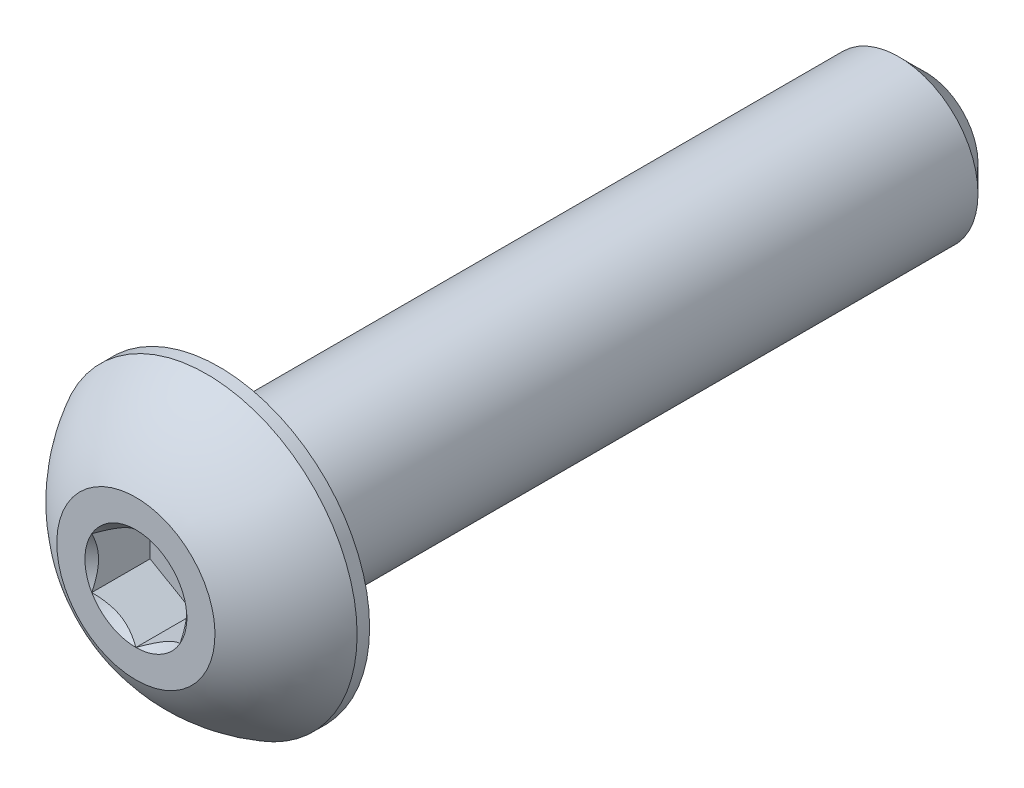
from build123d import *

# Parameters (mm, degrees)
SKETCH1_W          = 12.7
SKETCH1_H          = 1.4224
CHAMFER1_SIZE      = 0.47625
CUT_EXTRUDE2_DEPTH = 1.04902


with BuildPart() as part:
    # Sketch1 → Revolve1 (revolve)
    with BuildSketch(Plane(origin=(0, 0, 0), x_dir=(0, 0, -1), z_dir=(1, 0, 0))):
        with Locations((7.8486, 0.7112)):
            Rectangle(SKETCH1_W, SKETCH1_H)
    revolve(axis=Axis((0, 0, -14.1986), (0, 0, 1)))

    # Chamfer1
    chamfer1_edges = [part.edges().sort_by_distance(p)[0] for p in [
        (0, -1.4224, -14.1986),
    ]]
    chamfer(chamfer1_edges, length=CHAMFER1_SIZE)

    # Sketch7 → Revolve2 (revolve)
    with BuildSketch(Plane(origin=(0, 0, 0), x_dir=(0, 0, -1), z_dir=(1, 0, 0))):
        with BuildLine():
            Line((1.27381, 2.7051), (1.4986, 2.7051))
            Line((1.4986, 2.7051), (1.4986, 0))
            Line((1.4986, 0), (0, 0))
            Line((0, 0), (0, 1.4224))
            ThreePointArc((0, 1.4224), (0.540190256, 2.159794444), (1.27381, 2.7051))
        make_face()
    revolve(axis=Axis((0, 0, 0), (0, 0, -1)))

    # Sketch5 → Cut-Extrude2 (cut)
    with BuildSketch(Plane.XY):
        Polygon((0.79375, -0.458271776), (0.79375, 0.458271776), (0, 0.916543552), (-0.79375, 0.458271776), (-0.79375, -0.458271776), (0, -0.916543552), align=None)
    extrude(amount=-CUT_EXTRUDE2_DEPTH, mode=Mode.SUBTRACT)

    # Cut-Extrude3 cone 1 section (through the dimple's axis) → Cut-Extrude3 (revolve, cut)
    with BuildSketch(Plane(origin=(0, 0, 0), x_dir=(0, -1, 0), z_dir=(1, 0, 0))):
        Polygon((0, 0), (0.916543552, 0), (0, 0.916543552), align=None)
    revolve(axis=Axis((0, 0, 0), (0, 0, -1)), mode=Mode.SUBTRACT)


solid = part.part
